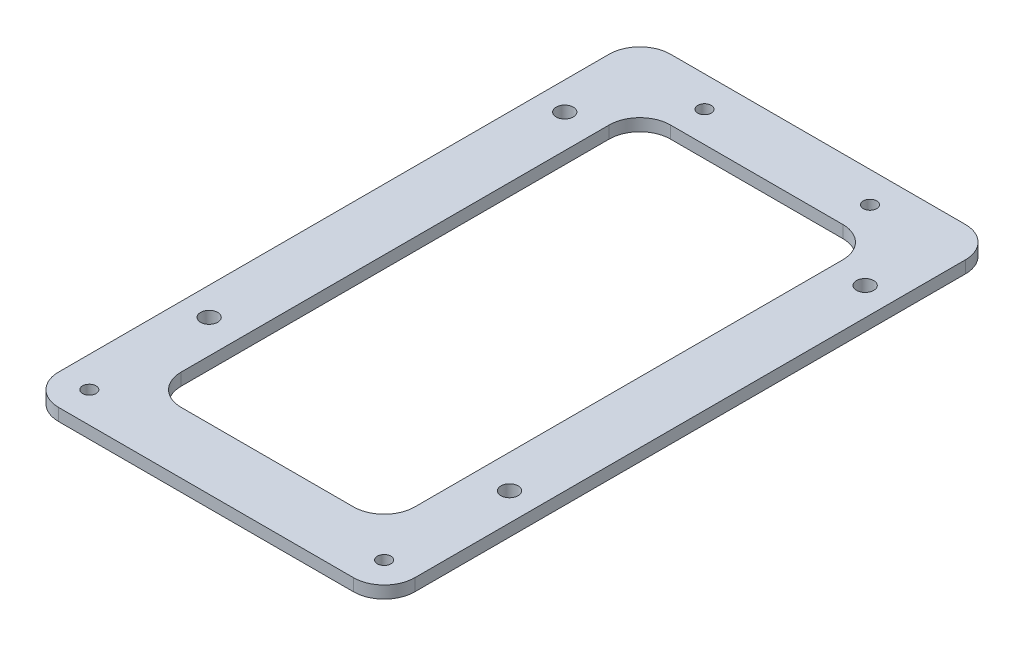
from build123d import *
from build123d.topology import SkipClean

# Parameters (mm, degrees)
SKETCH3_W           = 58.1
SKETCH3_H           = 99.8
SKETCH3_R           = 1.1
SKETCH3_R_2         = 0.95
SKETCH3_R_3         = 1.4
BOSS_EXTRUDE1_DEPTH = 2
FILLET1_R           = 5
FILLET2_R           = 3
FILLET3_R           = 10
BOSS_EXTRUDE2_START = 1
SKETCH4_R           = 1.6
SKETCH4_R_2         = 0.95
BOSS_EXTRUDE2_DEPTH = 1
SKETCH5_W           = 38.1
SKETCH5_H           = 61.132694782
CUT_EXTRUDE1_DEPTH  = 63.361145756


with BuildPart() as part:
    # Sketch3 → Boss-Extrude1 (new body)
    with BuildSketch(Plane(origin=(0, 0, 0), x_dir=(1, 0, 0), z_dir=(0, 1, 0))):
        with Locations((0, -5.2)):
            Rectangle(SKETCH3_W, SKETCH3_H)
        with Locations(Location((24.05, -50.1, 0), (0, 0, 270))):
            Circle(SKETCH3_R, mode=Mode.SUBTRACT)
        with Locations(Location((-10.3, -10.3, 0), (0, 0, 270))):
            Circle(SKETCH3_R_2, mode=Mode.SUBTRACT)
        with Locations(Location((13.5, 39.7, 0), (0, 0, 270))):
            Circle(SKETCH3_R, mode=Mode.SUBTRACT)
        with Locations(Location((-13.5, 39.7, 0), (0, 0, 270))):
            Circle(SKETCH3_R, mode=Mode.SUBTRACT)
        with Locations(Location((-24.05, -50.1, 0), (0, 0, 270))):
            Circle(SKETCH3_R, mode=Mode.SUBTRACT)
        with Locations(Location((-24.5, 27.9, 0), (0, 0, 270))):
            Circle(SKETCH3_R_3, mode=Mode.SUBTRACT)
        with Locations(Location((24.5, 27.9, 0), (0, 0, 270))):
            Circle(SKETCH3_R_3, mode=Mode.SUBTRACT)
        with Locations(Location((10.3, 10.3, 0), (0, 0, 270))):
            Circle(SKETCH3_R_2, mode=Mode.SUBTRACT)
        with Locations(Location((10.3, -10.3, 0), (0, 0, 270))):
            Circle(SKETCH3_R_2, mode=Mode.SUBTRACT)
        with Locations(Location((-10.3, 10.3, 0), (0, 0, 270))):
            Circle(SKETCH3_R_2, mode=Mode.SUBTRACT)
        with Locations(Location((-24.5, -30.1, 0), (0, 0, 270))):
            Circle(SKETCH3_R_3, mode=Mode.SUBTRACT)
        with Locations(Location((24.5, -30.1, 0), (0, 0, 270))):
            Circle(SKETCH3_R_3, mode=Mode.SUBTRACT)
        with BuildLine():
            Line((19.05, -45.1), (19.05, -22.090559159))
            Line((19.05, -22.090559159), (8.77972042, -11.82027958))
            ThreePointArc((8.77972042, -11.82027958), (8.77972042, -8.77972042), (11.82027958, -8.77972042))
            Line((11.82027958, -8.77972042), (19.05, -16.009440841))
            Line((19.05, -16.009440841), (19.05, 16.009440841))
            Line((19.05, 16.009440841), (11.82027958, 8.77972042))
            ThreePointArc((11.82027958, 8.77972042), (8.77972042, 8.77972042), (8.77972042, 11.82027958))
            Line((8.77972042, 11.82027958), (19.05, 22.090559159))
            Line((19.05, 22.090559159), (19.05, 34.7))
            Line((19.05, 34.7), (-19.05, 34.7))
            Line((-19.05, 34.7), (-19.05, 22.090559159))
            Line((-19.05, 22.090559159), (-8.77972042, 11.82027958))
            ThreePointArc((-8.77972042, 11.82027958), (-8.77972042, 8.77972042), (-11.82027958, 8.77972042))
            Line((-11.82027958, 8.77972042), (-19.05, 16.009440841))
            Line((-19.05, 16.009440841), (-19.05, -16.009440841))
            Line((-19.05, -16.009440841), (-11.82027958, -8.77972042))
            ThreePointArc((-11.82027958, -8.77972042), (-8.77972042, -8.77972042), (-8.77972042, -11.82027958))
            Line((-8.77972042, -11.82027958), (-19.05, -22.090559159))
            Line((-19.05, -22.090559159), (-19.05, -45.1))
            Line((-19.05, -45.1), (19.05, -45.1))
        make_face(mode=Mode.SUBTRACT)
    extrude(amount=BOSS_EXTRUDE1_DEPTH)

    # Fillet1
    fillet1_edges = [part.edges().sort_by_distance(p)[0] for p in [
        (19.05, 1, -34.7),
        (-19.05, 1, -34.7),
        (-19.05, 1, 45.1),
        (19.05, 1, 45.1),
        (29.05, 1, -44.7),
        (29.05, 1, 55.1),
        (-29.05, 1, 55.1),
        (-29.05, 1, -44.7),
    ]]
    fillet(fillet1_edges, radius=FILLET1_R)

    # Fillet2
    fillet2_edges = [part.edges().sort_by_distance(p)[0] for p in [
        (-19.05, 1, -16.009440841),
        (-19.05, 1, 16.009440841),
        (19.05, 1, 16.009440841),
        (19.05, 1, -16.009440841),
    ]]
    fillet(fillet2_edges, radius=FILLET2_R)

    # Fillet3
    fillet3_edges = [part.edges().sort_by_distance(p)[0] for p in [
        (19.05, 1, -22.090559159),
        (-19.05, 1, -22.090559159),
        (-19.05, 1, 22.090559159),
        (19.05, 1, 22.090559159),
    ]]
    fillet(fillet3_edges, radius=FILLET3_R)

    # Sketch4 → Boss-Extrude2 (add)
    # profile 1 of 4: a face of its own
    with SkipClean():  # the faces are left unmerged after this step: merging them gives an invalid solid
        with BuildSketch(Plane.XZ.offset(BOSS_EXTRUDE2_START)):
            with Locations(Location((-10.3, 10.3, 0), (0, 0, 90))):
                Circle(SKETCH4_R)
            with Locations(Location((-10.3, 10.3, 0), (0, 0, 270))):
                Circle(SKETCH4_R_2, mode=Mode.SUBTRACT)
        # profile 2 of 4: a face of its own
        with BuildSketch(Plane.XZ.offset(BOSS_EXTRUDE2_START)):
            with Locations(Location((10.3, 10.3, 0), (0, 0, 90))):
                Circle(SKETCH4_R)
            with Locations(Location((10.3, 10.3, 0), (0, 0, 270))):
                Circle(SKETCH4_R_2, mode=Mode.SUBTRACT)
        # profile 3 of 4: a face of its own
        with BuildSketch(Plane.XZ.offset(BOSS_EXTRUDE2_START)):
            with Locations(Location((10.3, -10.3, 0), (0, 0, 90))):
                Circle(SKETCH4_R)
            with Locations(Location((10.3, -10.3, 0), (0, 0, 270))):
                Circle(SKETCH4_R_2, mode=Mode.SUBTRACT)
        # profile 4 of 4: a face of its own
        with BuildSketch(Plane.XZ.offset(BOSS_EXTRUDE2_START)):
            with Locations(Location((-10.3, -10.3, 0), (0, 0, 90))):
                Circle(SKETCH4_R)
            with Locations(Location((-10.3, -10.3, 0), (0, 0, 270))):
                Circle(SKETCH4_R_2, mode=Mode.SUBTRACT)
        extrude(amount=-BOSS_EXTRUDE2_DEPTH)

    # Sketch5 → Cut-Extrude1 (cut, through all)
    with BuildSketch(Plane(origin=(0, 2, 0), x_dir=(1, 0, 0), z_dir=(0, 1, 0))):
        with Locations((0, -2.6)):
            Rectangle(SKETCH5_W, SKETCH5_H)
    extrude(amount=-CUT_EXTRUDE1_DEPTH, mode=Mode.SUBTRACT)


solid = part.part
